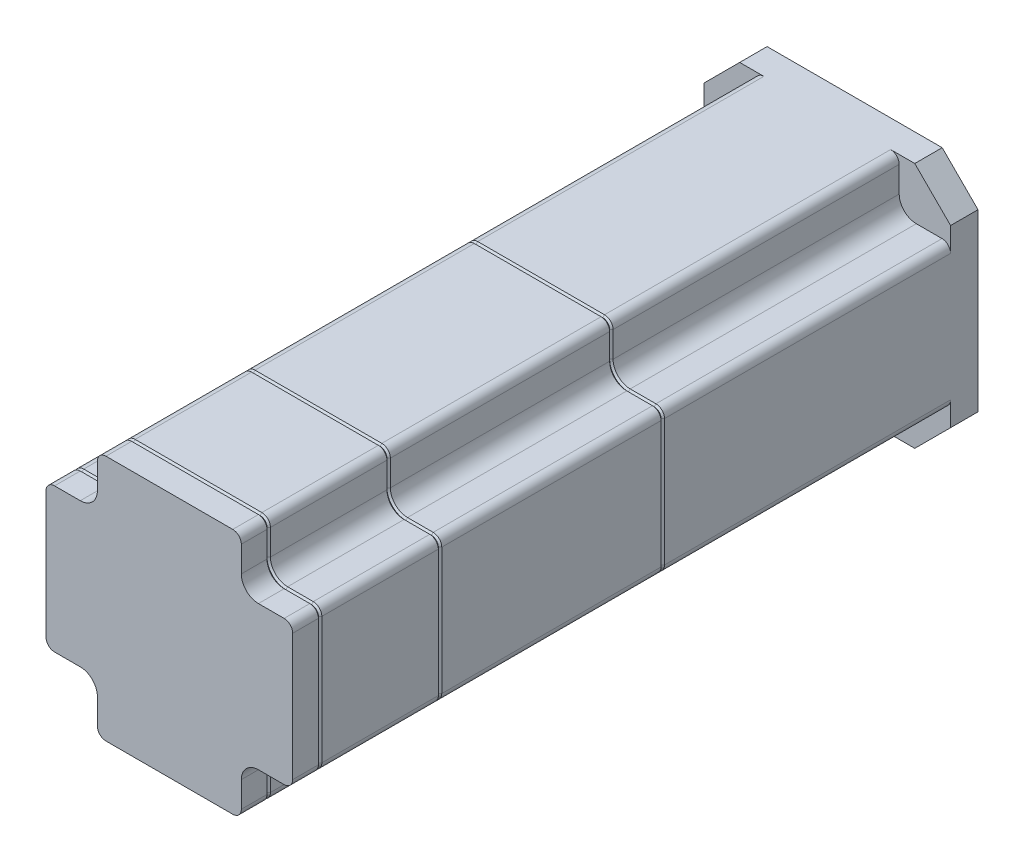
from build123d import *

# Parameters (mm, degrees)
SKETCH3_W                    = 72
SKETCH3_H                    = 72
BOSS_EXTRUDE2_DEPTH          = 8
CHAMFER1_SIZE                = 10.45
BOSS_EXTRUDE3_DEPTH          = 192
FILLET1_R                    = 2.5
CUT_EXTRUDE2_DEPTH           = 0.5
CUT_EXTRUDE2_TAPER           = 45
CUT_EXTRUDE2_OTHER_WAY_DEPTH = 0.5
CUT_EXTRUDE2_OTHER_WAY_TAPER = 45
CUT_EXTRUDE3_DEPTH           = 0.5
CUT_EXTRUDE3_TAPER           = 45
CUT_EXTRUDE3_OTHER_WAY_DEPTH = 0.5
CUT_EXTRUDE3_OTHER_WAY_TAPER = 45
CUT_EXTRUDE4_DEPTH           = 0.5
CUT_EXTRUDE4_TAPER           = 45
CUT_EXTRUDE4_OTHER_WAY_DEPTH = 0.5
CUT_EXTRUDE4_OTHER_WAY_TAPER = 45


with BuildPart() as part:
    # Sketch3 → Boss-Extrude2 (new body)
    with BuildSketch(Plane.XY):
        Rectangle(SKETCH3_W, SKETCH3_H)
    extrude(amount=BOSS_EXTRUDE2_DEPTH)

    # Chamfer1
    chamfer1_edges = [part.edges().sort_by_distance(p)[0] for p in [
        (36, -36, 4),
        (-36, -36, 4),
        (-36, 36, 4),
        (36, 36, 4),
    ]]
    chamfer(chamfer1_edges, length=CHAMFER1_SIZE)

    # Sketch5 → Boss-Extrude3 (add)
    with BuildSketch(Plane.XY.offset(8)):
        with BuildLine():
            Line((-36, 21), (-36, -21))
            Line((-36, -21), (-26, -21))
            ThreePointArc((-26, -21), (-22.464466094, -22.464466094), (-21, -26))
            Line((-21, -26), (-21, -36))
            Line((-21, -36), (21, -36))
            Line((21, -36), (21, -26))
            ThreePointArc((21, -26), (22.464466094, -22.464466094), (26, -21))
            Line((26, -21), (36, -21))
            Line((36, -21), (36, 21))
            Line((36, 21), (26, 21))
            ThreePointArc((26, 21), (22.464466094, 22.464466094), (21, 26))
            Line((21, 26), (21, 36))
            Line((21, 36), (-21, 36))
            Line((-21, 36), (-21, 26))
            ThreePointArc((-21, 26), (-22.464466094, 22.464466094), (-26, 21))
            Line((-26, 21), (-36, 21))
        make_face()
    extrude(amount=BOSS_EXTRUDE3_DEPTH)

    # Fillet1
    fillet1_edges = [part.edges().sort_by_distance(p)[0] for p in [
        (21, -36, 104),
        (36, -21, 104),
        (36, 21, 104),
        (21, 36, 104),
        (-21, 36, 104),
        (-36, 21, 104),
        (-36, -21, 104),
        (-21, -36, 104),
    ]]
    fillet(fillet1_edges, radius=FILLET1_R)

    # Sketch8 → Cut-Extrude2 (cut)
    with BuildSketch(Plane.XY.offset(192)):
        with BuildLine():
            Line((-46, 18.5), (-46, -18.5))
            ThreePointArc((-46, -18.5), (-42.338834765, -27.338834765), (-33.5, -31))
            Line((-33.5, -31), (-31, -31))
            Line((-31, -31), (-31, -33.5))
            ThreePointArc((-31, -33.5), (-27.338834765, -42.338834765), (-18.5, -46))
            Line((-18.5, -46), (18.5, -46))
            ThreePointArc((18.5, -46), (27.338834765, -42.338834765), (31, -33.5))
            Line((31, -33.5), (31, -31))
            Line((31, -31), (33.5, -31))
            ThreePointArc((33.5, -31), (42.338834765, -27.338834765), (46, -18.5))
            Line((46, -18.5), (46, 18.5))
            ThreePointArc((46, 18.5), (42.338834765, 27.338834765), (33.5, 31))
            Line((33.5, 31), (31, 31))
            Line((31, 31), (31, 33.5))
            ThreePointArc((31, 33.5), (27.338834765, 42.338834765), (18.5, 46))
            Line((18.5, 46), (-18.5, 46))
            ThreePointArc((-18.5, 46), (-27.338834765, 42.338834765), (-31, 33.5))
            Line((-31, 33.5), (-31, 31))
            Line((-31, 31), (-33.5, 31))
            ThreePointArc((-33.5, 31), (-42.338834765, 27.338834765), (-46, 18.5))
        make_face()
        with BuildLine():
            Line((-35.5, 18.5), (-35.5, -18.5))
            ThreePointArc((-35.5, -18.5), (-34.914213562, -19.914213562), (-33.5, -20.5))
            Line((-33.5, -20.5), (-26, -20.5))
            ThreePointArc((-26, -20.5), (-22.110912703, -22.110912703), (-20.5, -26))
            Line((-20.5, -26), (-20.5, -33.5))
            ThreePointArc((-20.5, -33.5), (-19.914213562, -34.914213562), (-18.5, -35.5))
            Line((-18.5, -35.5), (18.5, -35.5))
            ThreePointArc((18.5, -35.5), (19.914213562, -34.914213562), (20.5, -33.5))
            Line((20.5, -33.5), (20.5, -26))
            ThreePointArc((20.5, -26), (22.110912703, -22.110912703), (26, -20.5))
            Line((26, -20.5), (33.5, -20.5))
            ThreePointArc((33.5, -20.5), (34.914213562, -19.914213562), (35.5, -18.5))
            Line((35.5, -18.5), (35.5, 18.5))
            ThreePointArc((35.5, 18.5), (34.914213562, 19.914213562), (33.5, 20.5))
            Line((33.5, 20.5), (26, 20.5))
            ThreePointArc((26, 20.5), (22.110912703, 22.110912703), (20.5, 26))
            Line((20.5, 26), (20.5, 33.5))
            ThreePointArc((20.5, 33.5), (19.914213562, 34.914213562), (18.5, 35.5))
            Line((18.5, 35.5), (-18.5, 35.5))
            ThreePointArc((-18.5, 35.5), (-19.914213562, 34.914213562), (-20.5, 33.5))
            Line((-20.5, 33.5), (-20.5, 26))
            ThreePointArc((-20.5, 26), (-22.110912703, 22.110912703), (-26, 20.5))
            Line((-26, 20.5), (-33.5, 20.5))
            ThreePointArc((-33.5, 20.5), (-34.914213562, 19.914213562), (-35.5, 18.5))
        make_face(mode=Mode.SUBTRACT)
    extrude(amount=-CUT_EXTRUDE2_DEPTH, taper=CUT_EXTRUDE2_TAPER, mode=Mode.SUBTRACT)

    # Sketch8 → Cut-Extrude2 other way (cut)
    with BuildSketch(Plane.XY.offset(192)):
        with BuildLine():
            Line((-46, 18.5), (-46, -18.5))
            ThreePointArc((-46, -18.5), (-42.338834765, -27.338834765), (-33.5, -31))
            Line((-33.5, -31), (-31, -31))
            Line((-31, -31), (-31, -33.5))
            ThreePointArc((-31, -33.5), (-27.338834765, -42.338834765), (-18.5, -46))
            Line((-18.5, -46), (18.5, -46))
            ThreePointArc((18.5, -46), (27.338834765, -42.338834765), (31, -33.5))
            Line((31, -33.5), (31, -31))
            Line((31, -31), (33.5, -31))
            ThreePointArc((33.5, -31), (42.338834765, -27.338834765), (46, -18.5))
            Line((46, -18.5), (46, 18.5))
            ThreePointArc((46, 18.5), (42.338834765, 27.338834765), (33.5, 31))
            Line((33.5, 31), (31, 31))
            Line((31, 31), (31, 33.5))
            ThreePointArc((31, 33.5), (27.338834765, 42.338834765), (18.5, 46))
            Line((18.5, 46), (-18.5, 46))
            ThreePointArc((-18.5, 46), (-27.338834765, 42.338834765), (-31, 33.5))
            Line((-31, 33.5), (-31, 31))
            Line((-31, 31), (-33.5, 31))
            ThreePointArc((-33.5, 31), (-42.338834765, 27.338834765), (-46, 18.5))
        make_face()
        with BuildLine():
            Line((-35.5, 18.5), (-35.5, -18.5))
            ThreePointArc((-35.5, -18.5), (-34.914213562, -19.914213562), (-33.5, -20.5))
            Line((-33.5, -20.5), (-26, -20.5))
            ThreePointArc((-26, -20.5), (-22.110912703, -22.110912703), (-20.5, -26))
            Line((-20.5, -26), (-20.5, -33.5))
            ThreePointArc((-20.5, -33.5), (-19.914213562, -34.914213562), (-18.5, -35.5))
            Line((-18.5, -35.5), (18.5, -35.5))
            ThreePointArc((18.5, -35.5), (19.914213562, -34.914213562), (20.5, -33.5))
            Line((20.5, -33.5), (20.5, -26))
            ThreePointArc((20.5, -26), (22.110912703, -22.110912703), (26, -20.5))
            Line((26, -20.5), (33.5, -20.5))
            ThreePointArc((33.5, -20.5), (34.914213562, -19.914213562), (35.5, -18.5))
            Line((35.5, -18.5), (35.5, 18.5))
            ThreePointArc((35.5, 18.5), (34.914213562, 19.914213562), (33.5, 20.5))
            Line((33.5, 20.5), (26, 20.5))
            ThreePointArc((26, 20.5), (22.110912703, 22.110912703), (20.5, 26))
            Line((20.5, 26), (20.5, 33.5))
            ThreePointArc((20.5, 33.5), (19.914213562, 34.914213562), (18.5, 35.5))
            Line((18.5, 35.5), (-18.5, 35.5))
            ThreePointArc((-18.5, 35.5), (-19.914213562, 34.914213562), (-20.5, 33.5))
            Line((-20.5, 33.5), (-20.5, 26))
            ThreePointArc((-20.5, 26), (-22.110912703, 22.110912703), (-26, 20.5))
            Line((-26, 20.5), (-33.5, 20.5))
            ThreePointArc((-33.5, 20.5), (-34.914213562, 19.914213562), (-35.5, 18.5))
        make_face(mode=Mode.SUBTRACT)
    extrude(amount=CUT_EXTRUDE2_OTHER_WAY_DEPTH, taper=CUT_EXTRUDE2_OTHER_WAY_TAPER, mode=Mode.SUBTRACT)

    # Sketch9 → Cut-Extrude3 (cut)
    with BuildSketch(Plane.XY.offset(157)):
        with BuildLine():
            Line((31, -31), (33.5, -31))
            ThreePointArc((33.5, -31), (42.338834765, -27.338834765), (46, -18.5))
            Line((46, -18.5), (46, 18.5))
            ThreePointArc((46, 18.5), (42.338834765, 27.338834765), (33.5, 31))
            Line((33.5, 31), (31, 31))
            Line((31, 31), (31, 33.5))
            ThreePointArc((31, 33.5), (27.338834765, 42.338834765), (18.5, 46))
            Line((18.5, 46), (-18.5, 46))
            ThreePointArc((-18.5, 46), (-27.338834765, 42.338834765), (-31, 33.5))
            Line((-31, 33.5), (-31, 31))
            Line((-31, 31), (-33.5, 31))
            ThreePointArc((-33.5, 31), (-42.338834765, 27.338834765), (-46, 18.5))
            Line((-46, 18.5), (-46, -18.5))
            ThreePointArc((-46, -18.5), (-42.338834765, -27.338834765), (-33.5, -31))
            Line((-33.5, -31), (-31, -31))
            Line((-31, -31), (-31, -33.5))
            ThreePointArc((-31, -33.5), (-27.338834765, -42.338834765), (-18.5, -46))
            Line((-18.5, -46), (18.5, -46))
            ThreePointArc((18.5, -46), (27.338834765, -42.338834765), (31, -33.5))
            Line((31, -33.5), (31, -31))
        make_face()
        with BuildLine():
            Line((20.5, 26), (20.5, 33.5))
            ThreePointArc((20.5, 33.5), (19.914213562, 34.914213562), (18.5, 35.5))
            Line((18.5, 35.5), (-18.5, 35.5))
            ThreePointArc((-18.5, 35.5), (-19.914213562, 34.914213562), (-20.5, 33.5))
            Line((-20.5, 33.5), (-20.5, 26))
            ThreePointArc((-20.5, 26), (-22.110912703, 22.110912703), (-26, 20.5))
            Line((-26, 20.5), (-33.5, 20.5))
            ThreePointArc((-33.5, 20.5), (-34.914213562, 19.914213562), (-35.5, 18.5))
            Line((-35.5, 18.5), (-35.5, -18.5))
            ThreePointArc((-35.5, -18.5), (-34.914213562, -19.914213562), (-33.5, -20.5))
            Line((-33.5, -20.5), (-26, -20.5))
            ThreePointArc((-26, -20.5), (-22.110912703, -22.110912703), (-20.5, -26))
            Line((-20.5, -26), (-20.5, -33.5))
            ThreePointArc((-20.5, -33.5), (-19.914213562, -34.914213562), (-18.5, -35.5))
            Line((-18.5, -35.5), (18.5, -35.5))
            ThreePointArc((18.5, -35.5), (19.914213562, -34.914213562), (20.5, -33.5))
            Line((20.5, -33.5), (20.5, -26))
            ThreePointArc((20.5, -26), (22.110912703, -22.110912703), (26, -20.5))
            Line((26, -20.5), (33.5, -20.5))
            ThreePointArc((33.5, -20.5), (34.914213562, -19.914213562), (35.5, -18.5))
            Line((35.5, -18.5), (35.5, 18.5))
            ThreePointArc((35.5, 18.5), (34.914213562, 19.914213562), (33.5, 20.5))
            Line((33.5, 20.5), (26, 20.5))
            ThreePointArc((26, 20.5), (22.110912703, 22.110912703), (20.5, 26))
        make_face(mode=Mode.SUBTRACT)
    extrude(amount=-CUT_EXTRUDE3_DEPTH, taper=CUT_EXTRUDE3_TAPER, mode=Mode.SUBTRACT)

    # Sketch9 → Cut-Extrude3 other way (cut)
    with BuildSketch(Plane.XY.offset(157)):
        with BuildLine():
            Line((31, -31), (33.5, -31))
            ThreePointArc((33.5, -31), (42.338834765, -27.338834765), (46, -18.5))
            Line((46, -18.5), (46, 18.5))
            ThreePointArc((46, 18.5), (42.338834765, 27.338834765), (33.5, 31))
            Line((33.5, 31), (31, 31))
            Line((31, 31), (31, 33.5))
            ThreePointArc((31, 33.5), (27.338834765, 42.338834765), (18.5, 46))
            Line((18.5, 46), (-18.5, 46))
            ThreePointArc((-18.5, 46), (-27.338834765, 42.338834765), (-31, 33.5))
            Line((-31, 33.5), (-31, 31))
            Line((-31, 31), (-33.5, 31))
            ThreePointArc((-33.5, 31), (-42.338834765, 27.338834765), (-46, 18.5))
            Line((-46, 18.5), (-46, -18.5))
            ThreePointArc((-46, -18.5), (-42.338834765, -27.338834765), (-33.5, -31))
            Line((-33.5, -31), (-31, -31))
            Line((-31, -31), (-31, -33.5))
            ThreePointArc((-31, -33.5), (-27.338834765, -42.338834765), (-18.5, -46))
            Line((-18.5, -46), (18.5, -46))
            ThreePointArc((18.5, -46), (27.338834765, -42.338834765), (31, -33.5))
            Line((31, -33.5), (31, -31))
        make_face()
        with BuildLine():
            Line((20.5, 26), (20.5, 33.5))
            ThreePointArc((20.5, 33.5), (19.914213562, 34.914213562), (18.5, 35.5))
            Line((18.5, 35.5), (-18.5, 35.5))
            ThreePointArc((-18.5, 35.5), (-19.914213562, 34.914213562), (-20.5, 33.5))
            Line((-20.5, 33.5), (-20.5, 26))
            ThreePointArc((-20.5, 26), (-22.110912703, 22.110912703), (-26, 20.5))
            Line((-26, 20.5), (-33.5, 20.5))
            ThreePointArc((-33.5, 20.5), (-34.914213562, 19.914213562), (-35.5, 18.5))
            Line((-35.5, 18.5), (-35.5, -18.5))
            ThreePointArc((-35.5, -18.5), (-34.914213562, -19.914213562), (-33.5, -20.5))
            Line((-33.5, -20.5), (-26, -20.5))
            ThreePointArc((-26, -20.5), (-22.110912703, -22.110912703), (-20.5, -26))
            Line((-20.5, -26), (-20.5, -33.5))
            ThreePointArc((-20.5, -33.5), (-19.914213562, -34.914213562), (-18.5, -35.5))
            Line((-18.5, -35.5), (18.5, -35.5))
            ThreePointArc((18.5, -35.5), (19.914213562, -34.914213562), (20.5, -33.5))
            Line((20.5, -33.5), (20.5, -26))
            ThreePointArc((20.5, -26), (22.110912703, -22.110912703), (26, -20.5))
            Line((26, -20.5), (33.5, -20.5))
            ThreePointArc((33.5, -20.5), (34.914213562, -19.914213562), (35.5, -18.5))
            Line((35.5, -18.5), (35.5, 18.5))
            ThreePointArc((35.5, 18.5), (34.914213562, 19.914213562), (33.5, 20.5))
            Line((33.5, 20.5), (26, 20.5))
            ThreePointArc((26, 20.5), (22.110912703, 22.110912703), (20.5, 26))
        make_face(mode=Mode.SUBTRACT)
    extrude(amount=CUT_EXTRUDE3_OTHER_WAY_DEPTH, taper=CUT_EXTRUDE3_OTHER_WAY_TAPER, mode=Mode.SUBTRACT)

    # Sketch10 → Cut-Extrude4 (cut)
    with BuildSketch(Plane.XY.offset(92)):
        with BuildLine():
            Line((18.5, 46), (-18.5, 46))
            ThreePointArc((-18.5, 46), (-27.338834765, 42.338834765), (-31, 33.5))
            Line((-31, 33.5), (-31, 31))
            Line((-31, 31), (-33.5, 31))
            ThreePointArc((-33.5, 31), (-42.338834765, 27.338834765), (-46, 18.5))
            Line((-46, 18.5), (-46, -18.5))
            ThreePointArc((-46, -18.5), (-42.338834765, -27.338834765), (-33.5, -31))
            Line((-33.5, -31), (-31, -31))
            Line((-31, -31), (-31, -33.5))
            ThreePointArc((-31, -33.5), (-27.338834765, -42.338834765), (-18.5, -46))
            Line((-18.5, -46), (18.5, -46))
            ThreePointArc((18.5, -46), (27.338834765, -42.338834765), (31, -33.5))
            Line((31, -33.5), (31, -31))
            Line((31, -31), (33.5, -31))
            ThreePointArc((33.5, -31), (42.338834765, -27.338834765), (46, -18.5))
            Line((46, -18.5), (46, 18.5))
            ThreePointArc((46, 18.5), (42.338834765, 27.338834765), (33.5, 31))
            Line((33.5, 31), (31, 31))
            Line((31, 31), (31, 33.5))
            ThreePointArc((31, 33.5), (27.338834765, 42.338834765), (18.5, 46))
        make_face()
        with BuildLine():
            Line((-18.5, -35.5), (18.5, -35.5))
            ThreePointArc((18.5, -35.5), (19.914213562, -34.914213562), (20.5, -33.5))
            Line((20.5, -33.5), (20.5, -26))
            ThreePointArc((20.5, -26), (22.110912703, -22.110912703), (26, -20.5))
            Line((26, -20.5), (33.5, -20.5))
            ThreePointArc((33.5, -20.5), (34.914213562, -19.914213562), (35.5, -18.5))
            Line((35.5, -18.5), (35.5, 18.5))
            ThreePointArc((35.5, 18.5), (34.914213562, 19.914213562), (33.5, 20.5))
            Line((33.5, 20.5), (26, 20.5))
            ThreePointArc((26, 20.5), (22.110912703, 22.110912703), (20.5, 26))
            Line((20.5, 26), (20.5, 33.5))
            ThreePointArc((20.5, 33.5), (19.914213562, 34.914213562), (18.5, 35.5))
            Line((18.5, 35.5), (-18.5, 35.5))
            ThreePointArc((-18.5, 35.5), (-19.914213562, 34.914213562), (-20.5, 33.5))
            Line((-20.5, 33.5), (-20.5, 26))
            ThreePointArc((-20.5, 26), (-22.110912703, 22.110912703), (-26, 20.5))
            Line((-26, 20.5), (-33.5, 20.5))
            ThreePointArc((-33.5, 20.5), (-34.914213562, 19.914213562), (-35.5, 18.5))
            Line((-35.5, 18.5), (-35.5, -18.5))
            ThreePointArc((-35.5, -18.5), (-34.914213562, -19.914213562), (-33.5, -20.5))
            Line((-33.5, -20.5), (-26, -20.5))
            ThreePointArc((-26, -20.5), (-22.110912703, -22.110912703), (-20.5, -26))
            Line((-20.5, -26), (-20.5, -33.5))
            ThreePointArc((-20.5, -33.5), (-19.914213562, -34.914213562), (-18.5, -35.5))
        make_face(mode=Mode.SUBTRACT)
    extrude(amount=-CUT_EXTRUDE4_DEPTH, taper=CUT_EXTRUDE4_TAPER, mode=Mode.SUBTRACT)

    # Sketch10 → Cut-Extrude4 other way (cut)
    with BuildSketch(Plane.XY.offset(92)):
        with BuildLine():
            Line((18.5, 46), (-18.5, 46))
            ThreePointArc((-18.5, 46), (-27.338834765, 42.338834765), (-31, 33.5))
            Line((-31, 33.5), (-31, 31))
            Line((-31, 31), (-33.5, 31))
            ThreePointArc((-33.5, 31), (-42.338834765, 27.338834765), (-46, 18.5))
            Line((-46, 18.5), (-46, -18.5))
            ThreePointArc((-46, -18.5), (-42.338834765, -27.338834765), (-33.5, -31))
            Line((-33.5, -31), (-31, -31))
            Line((-31, -31), (-31, -33.5))
            ThreePointArc((-31, -33.5), (-27.338834765, -42.338834765), (-18.5, -46))
            Line((-18.5, -46), (18.5, -46))
            ThreePointArc((18.5, -46), (27.338834765, -42.338834765), (31, -33.5))
            Line((31, -33.5), (31, -31))
            Line((31, -31), (33.5, -31))
            ThreePointArc((33.5, -31), (42.338834765, -27.338834765), (46, -18.5))
            Line((46, -18.5), (46, 18.5))
            ThreePointArc((46, 18.5), (42.338834765, 27.338834765), (33.5, 31))
            Line((33.5, 31), (31, 31))
            Line((31, 31), (31, 33.5))
            ThreePointArc((31, 33.5), (27.338834765, 42.338834765), (18.5, 46))
        make_face()
        with BuildLine():
            Line((-18.5, -35.5), (18.5, -35.5))
            ThreePointArc((18.5, -35.5), (19.914213562, -34.914213562), (20.5, -33.5))
            Line((20.5, -33.5), (20.5, -26))
            ThreePointArc((20.5, -26), (22.110912703, -22.110912703), (26, -20.5))
            Line((26, -20.5), (33.5, -20.5))
            ThreePointArc((33.5, -20.5), (34.914213562, -19.914213562), (35.5, -18.5))
            Line((35.5, -18.5), (35.5, 18.5))
            ThreePointArc((35.5, 18.5), (34.914213562, 19.914213562), (33.5, 20.5))
            Line((33.5, 20.5), (26, 20.5))
            ThreePointArc((26, 20.5), (22.110912703, 22.110912703), (20.5, 26))
            Line((20.5, 26), (20.5, 33.5))
            ThreePointArc((20.5, 33.5), (19.914213562, 34.914213562), (18.5, 35.5))
            Line((18.5, 35.5), (-18.5, 35.5))
            ThreePointArc((-18.5, 35.5), (-19.914213562, 34.914213562), (-20.5, 33.5))
            Line((-20.5, 33.5), (-20.5, 26))
            ThreePointArc((-20.5, 26), (-22.110912703, 22.110912703), (-26, 20.5))
            Line((-26, 20.5), (-33.5, 20.5))
            ThreePointArc((-33.5, 20.5), (-34.914213562, 19.914213562), (-35.5, 18.5))
            Line((-35.5, 18.5), (-35.5, -18.5))
            ThreePointArc((-35.5, -18.5), (-34.914213562, -19.914213562), (-33.5, -20.5))
            Line((-33.5, -20.5), (-26, -20.5))
            ThreePointArc((-26, -20.5), (-22.110912703, -22.110912703), (-20.5, -26))
            Line((-20.5, -26), (-20.5, -33.5))
            ThreePointArc((-20.5, -33.5), (-19.914213562, -34.914213562), (-18.5, -35.5))
        make_face(mode=Mode.SUBTRACT)
    extrude(amount=CUT_EXTRUDE4_OTHER_WAY_DEPTH, taper=CUT_EXTRUDE4_OTHER_WAY_TAPER, mode=Mode.SUBTRACT)


solid = part.part
